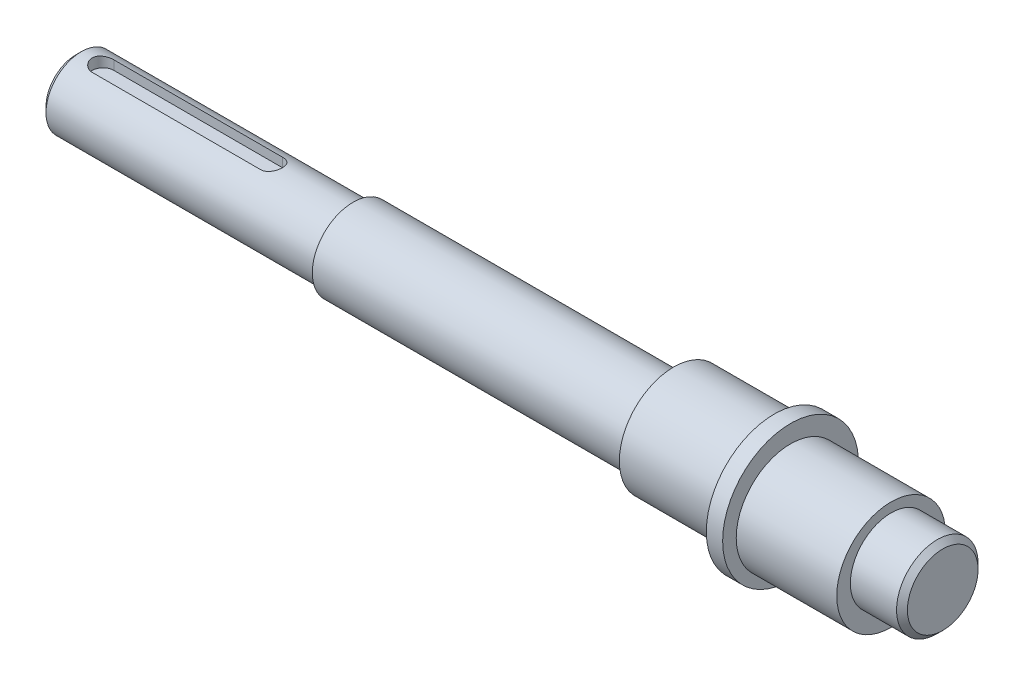
from build123d import *

# Parameters (mm, degrees)
CUT_EXTRUDE_START   = 13
CUT_EXTRUDE_1_DEPTH = 4
SKETCH_3_R          = 20
EXTRUDE_1_DEPTH     = 37
SKETCH_4_R          = 20
EXTRUDE_2_DEPTH     = 37
CHAMFER_1_SIZE      = 2


with BuildPart() as part:
    # 草图1 → 旋转1 (revolve)
    with BuildSketch(Plane.XY, mode=Mode.PRIVATE) as revolve_1_sk:
        Polygon((0, 0), (0, 13), (102, 13), (102, 15), (220, 15), (257, 15), (257, 25), (263, 25), (263, 15), (300, 15), (319, 15), (319, 0), align=None)
    revolve(revolve_1_sk.sketch.rotate(Axis((0, 0, 0), (1, 0, 0)), 90), axis=Axis((0, 0, 0), (1, 0, 0)))

    # 草图2 → 切除-拉伸1 (cut)
    with BuildSketch(Plane(origin=(0, 0, 0), x_dir=(1, 0, 0), z_dir=(0, 1, 0)).offset(CUT_EXTRUDE_START)):
        with BuildLine():
            Line((10, 4), (72, 4))
            ThreePointArc((72, 4), (76, 0), (72, -4))
            Line((72, -4), (10, -4))
            ThreePointArc((10, -4), (6, 0), (10, 4))
        make_face()
    extrude(amount=-CUT_EXTRUDE_1_DEPTH, mode=Mode.SUBTRACT)

    # 草图3 → 凸台-拉伸1 (add)
    with BuildSketch(Plane.ZY.offset(-257)):
        with Locations(Location((0, 1.5, 0), (0, 0, 180))):
            Circle(SKETCH_3_R)
    extrude(amount=EXTRUDE_1_DEPTH)

    # 草图4 → 凸台-拉伸2 (add)
    with BuildSketch(Plane(origin=(263, 0, 0), x_dir=(0, 0, -1), z_dir=(1, 0, 0))):
        with Locations(Location((0, -1.5, 0), (0, 0, 180))):
            Circle(SKETCH_4_R)
    extrude(amount=EXTRUDE_2_DEPTH)

    # 倒角1
    chamfer_1_edges = [part.edges().sort_by_distance(p)[0] for p in [
        (0, 0, -13),
        (319, 0, -15),
    ]]
    chamfer(chamfer_1_edges, length=CHAMFER_1_SIZE)

    # 草图5 → 切除-旋转1 (revolve, cut)
    with BuildSketch(Plane.XY, mode=Mode.PRIVATE) as cut_revolve_1_sk:
        Polygon((65.25, -13), (69.25, -9), (69.25, -13), align=None)
    revolve(cut_revolve_1_sk.sketch.rotate(Axis((69.25, -17.970703126, 0), (0, 1, 0)), 270), axis=Axis((69.25, -17.970703126, 0), (0, 1, 0)), mode=Mode.SUBTRACT)


solid = part.part
